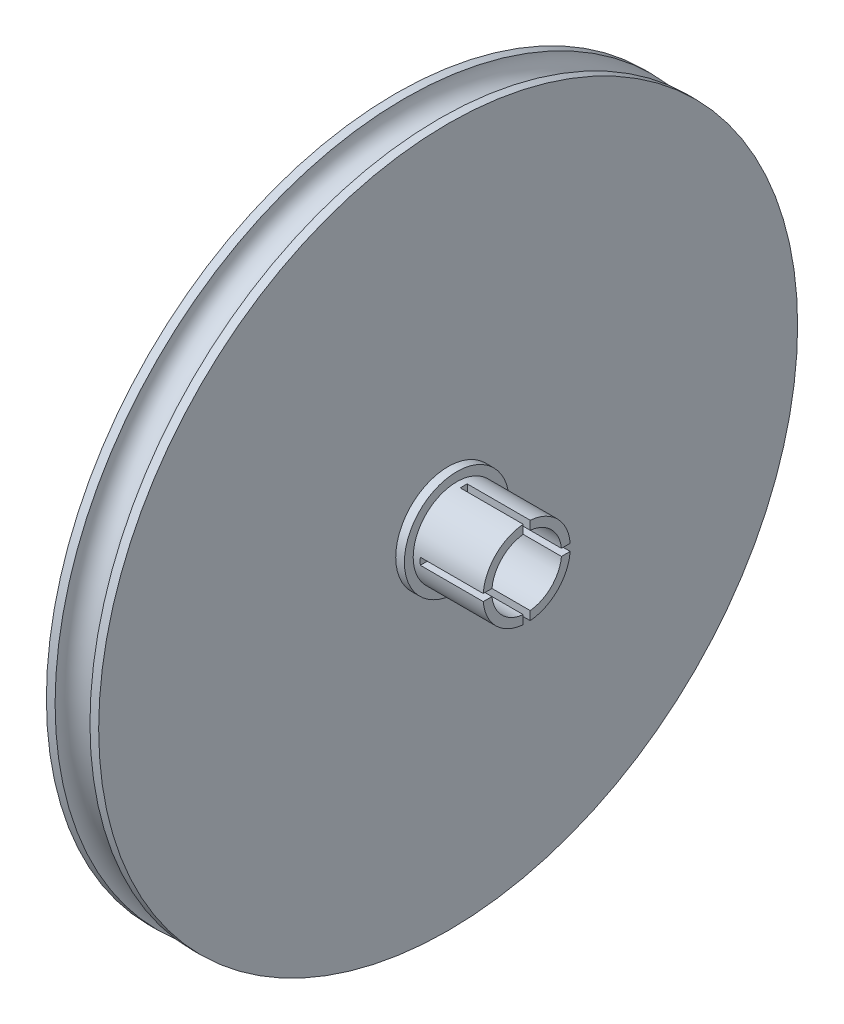
from build123d import *

# Parameters (mm, degrees)
SKETCH2_W               = 6.35
SKETCH2_H               = 0.8001
CUT_EXTRUDE1_SLOT_START = -5.715
CUT_EXTRUDE1_SLOT_DEPTH = 5.715
CIRPATTERN1_COUNT       = 4


with BuildPart() as part:
    # Sketch1 → Revolve1-MAIN BODY (revolve)
    with BuildSketch(Plane.XY, mode=Mode.PRIVATE) as revolve1_main_body_sk:
        with BuildLine():
            Line((0, 31.75), (0.79155417, 31.75))
            ThreePointArc((0.79155417, 31.75), (2.3749, 30.16665417), (3.95824583, 31.75))
            Line((3.95824583, 31.75), (4.7498, 31.75))
            Line((4.7498, 31.75), (4.7498, 4.7625))
            Line((4.7498, 4.7625), (11.8872, 4.7625))
            Line((11.8872, 4.7625), (11.8872, 3.17246))
            Line((11.8872, 3.17246), (0, 3.17246))
            Line((0, 3.17246), (0, 31.75))
        make_face()
    revolve(revolve1_main_body_sk.sketch.rotate(Axis((0, 0, 0), (1, 0, 0)), 90), axis=Axis((0, 0, 0), (1, 0, 0)))

    # Sketch2 → Cut-Revolve1-SLOT (revolve, cut)
    with BuildSketch(Plane.XY, mode=Mode.PRIVATE) as cut_revolve1_slot_sk:
        with Locations((8.7122, 4.36245)):
            Rectangle(SKETCH2_W, SKETCH2_H)
    revolve(cut_revolve1_slot_sk.sketch.rotate(Axis((0, 0, 0), (1, 0, 0)), 90), axis=Axis((0, 0, 0), (1, 0, 0)), mode=Mode.SUBTRACT)

    # Sketch3 → Cut-Extrude1-SLOT (cut)
    with BuildSketch(Plane(origin=(11.8872, 0, 0), x_dir=(0, 0, -1), z_dir=(1, 0, 0)).offset(CUT_EXTRUDE1_SLOT_START)):
        with BuildLine():
            Line((-0.3175, 3.949659164), (-0.3175, 3.156532306))
            ThreePointArc((-0.3175, 3.156532306), (0, 3.17246), (0.3175, 3.156532306))
            Line((0.3175, 3.156532306), (0.3175, 3.949659164))
            ThreePointArc((0.3175, 3.949659164), (0, 3.9624), (-0.3175, 3.949659164))
        make_face()
    cut_extrude1_slot = extrude(amount=CUT_EXTRUDE1_SLOT_DEPTH, mode=Mode.SUBTRACT)

    # CirPattern1: Cut-Extrude1-SLOT ×4 about axis
    cirpattern1_axis = Axis((0, 0, 0), (1, 0, 0))
    for i in range(1, CIRPATTERN1_COUNT):
        add(cut_extrude1_slot.rotate(cirpattern1_axis, i * 360 / CIRPATTERN1_COUNT), mode=Mode.SUBTRACT)


solid = part.part
